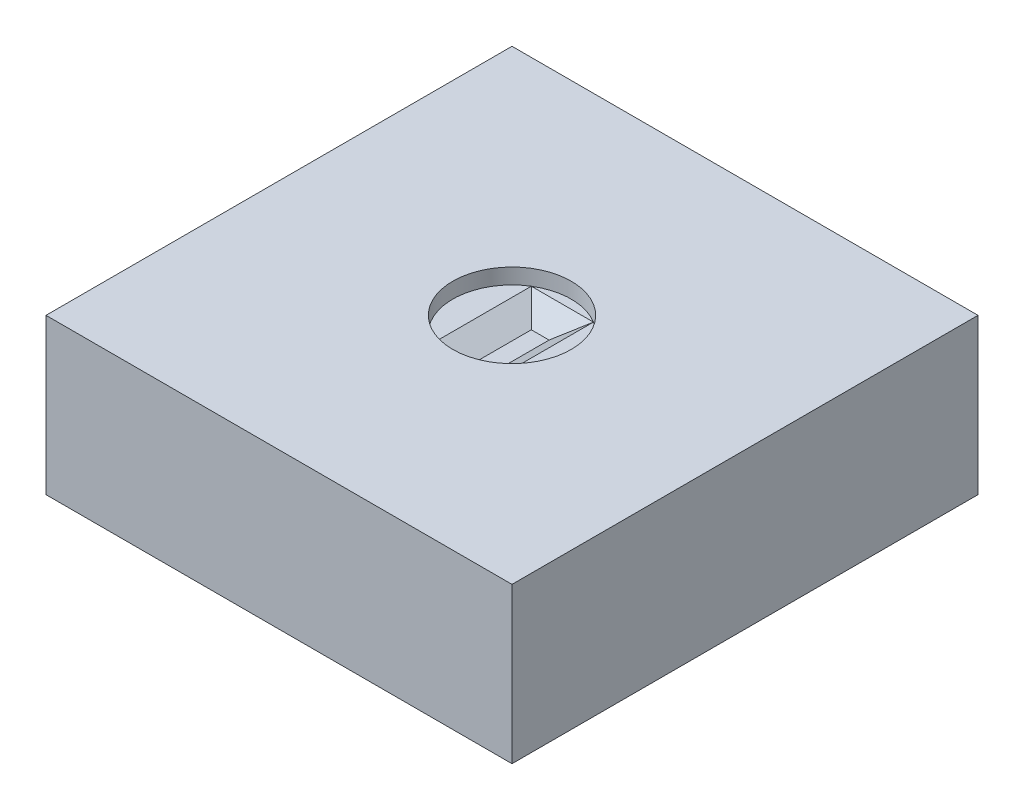
from build123d import *

# Parameters (mm, degrees)
SKETCH1_W           = 30
SKETCH1_H           = 30
BOSS_EXTRUDE1_DEPTH = 10
SKETCH2_R           = 3.81
BORE_DEPTH          = 1
SKETCH3_W           = 4
SKETCH3_H           = 6.485707364
GROOVE_DEPTH        = 1
GROOVE_DRAFT        = -55


with BuildPart() as part:
    # Sketch1 → Boss-Extrude1 (new body)
    with BuildSketch(Plane(origin=(0, 0, 0), x_dir=(1, 0, 0), z_dir=(0, 1, 0))):
        Rectangle(SKETCH1_W, SKETCH1_H)
    extrude(amount=BOSS_EXTRUDE1_DEPTH)

    # Sketch2 → bore (cut)
    with BuildSketch(Plane(origin=(0, 10, 0), x_dir=(1, 0, 0), z_dir=(0, 1, 0))):
        with Locations(Location((0, 0, 0), (0, 0, 270))):
            Circle(SKETCH2_R)
    extrude(amount=-BORE_DEPTH, mode=Mode.SUBTRACT)


with BuildPart() as groove_tool:
    # Sketch3 → groove (with draft: the straight prism first)
    with BuildSketch(Plane(origin=(0, 9, 0), x_dir=(1, 0, 0), z_dir=(0, 1, 0))):
        Rectangle(SKETCH3_W, SKETCH3_H)
    extrude(amount=-GROOVE_DEPTH)
    # groove: the draft: its side faces are tilted about the plane it starts from
    groove_sides = [groove_tool.faces().sort_by_distance(p)[0] for p in [
        (-2, 8.5, 0),
        (0, 8.5, 3.242853682),
        (2, 8.5, 0),
        (0, 8.5, -3.242853682),
    ]]
    draft(groove_sides, Plane(origin=(0, 9, 0), x_dir=(1, 0, 0), z_dir=(0, 1, 0)), GROOVE_DRAFT)


with BuildPart() as part_1:
    add(part.part)

    # groove: cut by groove_tool
    add(groove_tool.part, mode=Mode.SUBTRACT)


solid = part_1.part
